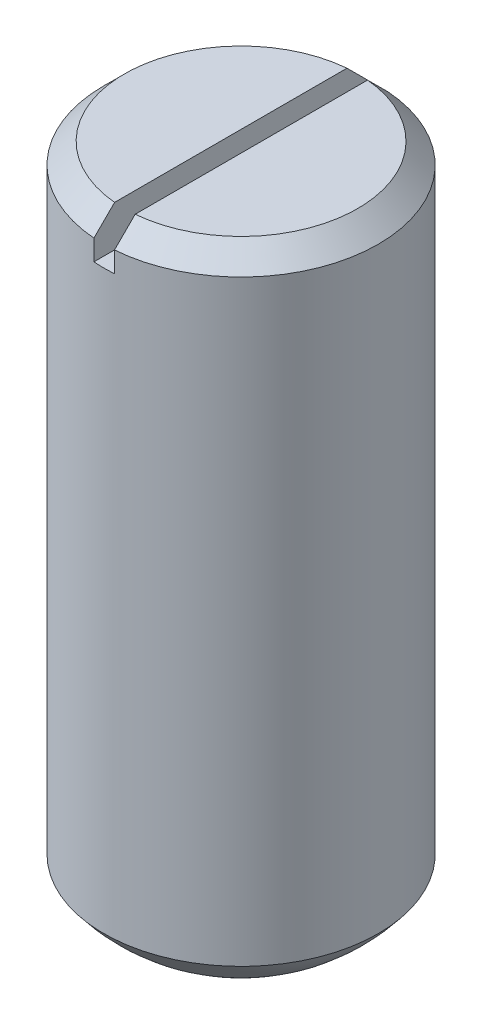
from build123d import *

# Parameters (mm, degrees)
ESQUISSE2_W = 0.3
ESQUISSE2_H = 4
FENTE_DEPTH = 0.6


with BuildPart() as part:
    # Esquisse1 → Tige (revolve)
    with BuildSketch(Plane.XY):
        with BuildLine():
            Line((0, 0), (1.7, 0))
            Line((1.7, 0), (2, -0.3))
            Line((2, -0.3), (2, -9))
            ThreePointArc((2, -9), (1.118033989, -9.736067977), (0, -10))
            Line((0, -10), (0, 0))
        make_face()
    revolve(axis=Axis((0, 0, 0), (0, 1, 0)))

    # Esquisse2 → Fente (cut)
    with BuildSketch(Plane(origin=(0, 0, 0), x_dir=(1, 0, 0), z_dir=(0, 1, 0))):
        Rectangle(ESQUISSE2_W, ESQUISSE2_H)
    extrude(amount=-FENTE_DEPTH, mode=Mode.SUBTRACT)


solid = part.part
